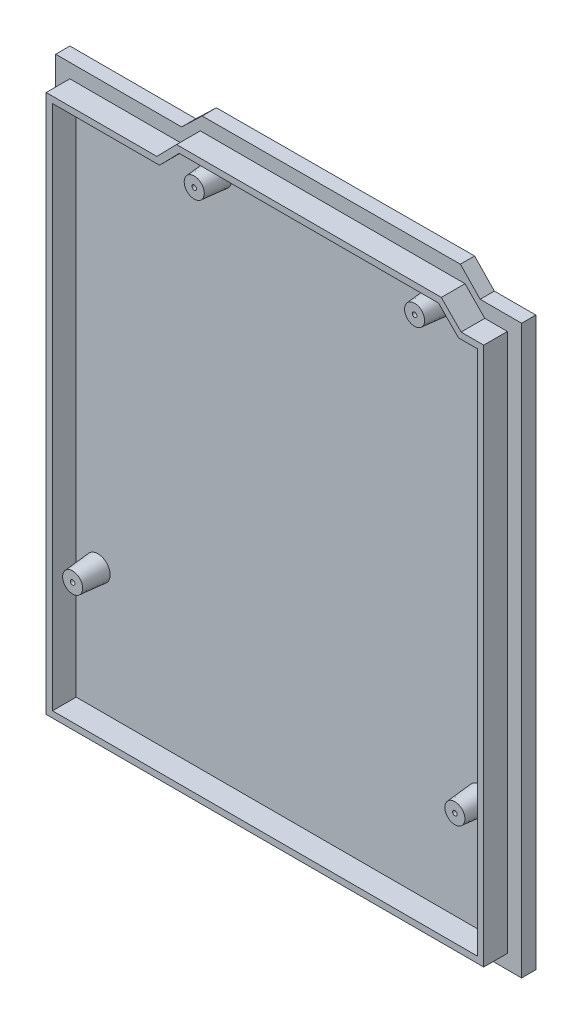
from build123d import *

# Parameters (mm, degrees)
BOSS_EXTRUDE1_DEPTH           = 1.8
EXTRUDE_THIN1_START           = 1.8
EXTRUDE_THIN1_DEPTH           = 3
SKETCH7_R                     = 1.55
SKETCH7_R_2                   = 0.01
EXTRUDE_THIN2_DEPTH           = 3.2
EXTRUDE_THIN2_DRAFT           = 5
EXTRUDE_THIN2_PROFILE_2_DEPTH = 3.2
EXTRUDE_THIN2_PROFILE_2_DRAFT = 5
EXTRUDE_THIN2_PROFILE_3_DEPTH = 3.2
EXTRUDE_THIN2_PROFILE_3_DRAFT = 5
EXTRUDE_THIN2_PROFILE_4_DEPTH = 3.2
EXTRUDE_THIN2_PROFILE_4_DRAFT = 5


with BuildPart() as part:
    # Sketch1 → Boss-Extrude1 (new body)
    with BuildSketch(Plane(origin=(0, 0, 0), x_dir=(0, 1, 0), z_dir=(0, 0, 1))):
        Polygon((40.609900374, 53.452613812), (-31.190099626, 53.452613812), (-31.190099626, -5.547386188), (40.609900374, -5.547386188), (40.609900374, -0.297386188), (43.209900374, 2.202613812), (43.109900374, 34.902613812), (40.609900374, 37.502613812), align=None)
    extrude(amount=BOSS_EXTRUDE1_DEPTH)

    # Sketch5 → Extrude-Thin1 (add)
    with BuildSketch(Plane(origin=(0, 0, 0), x_dir=(0, 1, 0), z_dir=(0, 0, 1)).offset(EXTRUDE_THIN1_START)):
        Polygon((-29.390099626, 51.652613812), (-29.390099626, -3.747386188), (38.809900374, -3.747386188), (38.809900374, -0.88342499), (41.360418353, 1.616884702), (41.360418353, 35.141633158), (38.809900374, 37.64194285), (38.809900374, 51.652613812), align=None)
        Polygon((-28.590099626, 50.852613812), (-28.590099626, -2.947386188), (38.009900374, -2.947386188), (38.009900374, -0.547386188), (40.560418353, 1.952923505), (40.560418353, 34.805594355), (38.009900374, 37.305904047), (38.009900374, 50.852613812), align=None, mode=Mode.SUBTRACT)
    extrude(amount=EXTRUDE_THIN1_DEPTH)


with BuildPart() as extrude_thin2_tool:
    # Sketch7 → Extrude-Thin2 (with draft: the straight prism first)
    with BuildSketch(Plane.XY.offset(1.8)):
        with Locations((-4.802613812, 37.960418353)):
            Circle(SKETCH7_R)
        with Locations((-4.802613812, 37.960418353)):
            Circle(SKETCH7_R_2, mode=Mode.SUBTRACT)
    extrude(amount=EXTRUDE_THIN2_DEPTH)
    # Extrude-Thin2: the draft: its side faces are tilted about the plane it starts from
    extrude_thin2_sides = [extrude_thin2_tool.faces().sort_by_distance(p)[0] for p in [
        (-6.352613812, 37.960418353, 3.4),
        (-4.812613812, 37.960418353, 3.4),
    ]]
    draft(extrude_thin2_sides, Plane.XY.offset(1.8), EXTRUDE_THIN2_DRAFT)


with BuildPart() as part_1:
    add(part.part)

    # Extrude-Thin2: add extrude_thin2_tool
    add(extrude_thin2_tool.part)


with BuildPart() as extrude_thin2_profile_2_tool:
    # Sketch7 → Extrude-Thin2 profile 2 (with draft: the straight prism first)
    with BuildSketch(Plane.XY.offset(1.8)):
        with Locations((-32.702613812, 37.960418353)):
            Circle(SKETCH7_R)
        with Locations((-32.702613812, 37.960418353)):
            Circle(SKETCH7_R_2, mode=Mode.SUBTRACT)
    extrude(amount=EXTRUDE_THIN2_PROFILE_2_DEPTH)
    # Extrude-Thin2 profile 2: the draft: its side faces are tilted about the plane it starts from
    extrude_thin2_profile_2_sides = [extrude_thin2_profile_2_tool.faces().sort_by_distance(p)[0] for p in [
        (-34.252613812, 37.960418353, 3.4),
        (-32.712613812, 37.960418353, 3.4),
    ]]
    draft(extrude_thin2_profile_2_sides, Plane.XY.offset(1.8), EXTRUDE_THIN2_PROFILE_2_DRAFT)


with BuildPart() as part_2:
    add(part_1.part)

    # Extrude-Thin2 profile 2: add extrude_thin2_profile_2_tool
    add(extrude_thin2_profile_2_tool.part)


with BuildPart() as extrude_thin2_profile_3_tool:
    # Sketch7 → Extrude-Thin2 profile 3 (with draft: the straight prism first)
    with BuildSketch(Plane.XY.offset(1.8)):
        with Locations((0.297386188, -14.140099626)):
            Circle(SKETCH7_R)
        with Locations((0.297386188, -14.140099626)):
            Circle(SKETCH7_R_2, mode=Mode.SUBTRACT)
    extrude(amount=EXTRUDE_THIN2_PROFILE_3_DEPTH)
    # Extrude-Thin2 profile 3: the draft: its side faces are tilted about the plane it starts from
    extrude_thin2_profile_3_sides = [extrude_thin2_profile_3_tool.faces().sort_by_distance(p)[0] for p in [
        (-1.252613812, -14.140099626, 3.4),
        (0.287386188, -14.140099626, 3.4),
    ]]
    draft(extrude_thin2_profile_3_sides, Plane.XY.offset(1.8), EXTRUDE_THIN2_PROFILE_3_DRAFT)


with BuildPart() as part_3:
    add(part_2.part)

    # Extrude-Thin2 profile 3: add extrude_thin2_profile_3_tool
    add(extrude_thin2_profile_3_tool.part)


with BuildPart() as extrude_thin2_profile_4_tool:
    # Sketch7 → Extrude-Thin2 profile 4 (with draft: the straight prism first)
    with BuildSketch(Plane.XY.offset(1.8)):
        with Locations((-48.102613812, -13.040099626)):
            Circle(SKETCH7_R)
        with Locations((-48.102613812, -13.040099626)):
            Circle(SKETCH7_R_2, mode=Mode.SUBTRACT)
    extrude(amount=EXTRUDE_THIN2_PROFILE_4_DEPTH)
    # Extrude-Thin2 profile 4: the draft: its side faces are tilted about the plane it starts from
    extrude_thin2_profile_4_sides = [extrude_thin2_profile_4_tool.faces().sort_by_distance(p)[0] for p in [
        (-49.652613812, -13.040099626, 3.4),
        (-48.112613812, -13.040099626, 3.4),
    ]]
    draft(extrude_thin2_profile_4_sides, Plane.XY.offset(1.8), EXTRUDE_THIN2_PROFILE_4_DRAFT)


with BuildPart() as part_4:
    add(part_3.part)

    # Extrude-Thin2 profile 4: add extrude_thin2_profile_4_tool
    add(extrude_thin2_profile_4_tool.part)


solid = part_4.part
